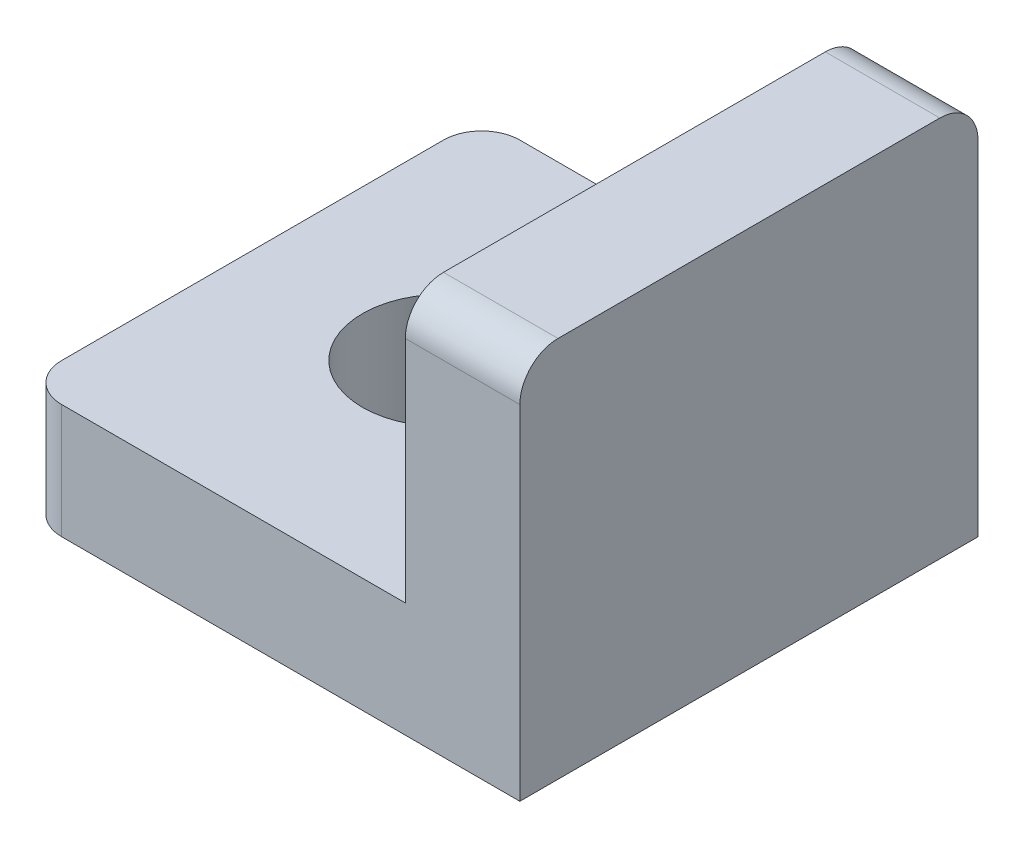
from build123d import *

# Parameters (mm, degrees)
SKETCH_1_W          = 13
SKETCH_1_H          = 12
EXTRUDE_1_DEPTH     = 10
SHELL_1_T           = -3
SKETCH_2_R          = 2.125
CUT_EXTRUDE_1_DEPTH = 13.206555616
SKETCH_3_R          = 2.625
CUT_EXTRUDE_4_DEPTH = 2.5
FILLET_1_R          = 1


with BuildPart() as part:
    # 草圖1 → 填料-伸長1 (new body)
    with BuildSketch(Plane(origin=(0, 0, 0), x_dir=(1, 0, 0), z_dir=(0, 1, 0))):
        with Locations((1.5, 0)):
            Rectangle(SKETCH_1_W, SKETCH_1_H)
    extrude(amount=EXTRUDE_1_DEPTH)

    # 薄殼1
    shell_1_openings = [part.faces().sort_by_distance(p)[0] for p in [
        (1.5, 10, 0),
        (1.5, 5, -6),
        (1.5, 5, 6),
        (-5, 5, 0),
    ]]
    offset(amount=SHELL_1_T, openings=shell_1_openings, kind=Kind.INTERSECTION)

    # 草圖2 → 除料-伸長1 (cut, through all)
    with BuildSketch(Plane(origin=(0, 3, 0), x_dir=(1, 0, 0), z_dir=(0, 1, 0))):
        with Locations(Location((0, 0, 0), (0, 0, 270))):
            Circle(SKETCH_2_R)
    extrude(amount=-CUT_EXTRUDE_1_DEPTH, mode=Mode.SUBTRACT)

    # 草圖3 → 除料-伸長4 (cut)
    with BuildSketch(Plane(origin=(5, 0, 0), x_dir=(0, 0, -1), z_dir=(1, 0, 0))):
        with Locations((0, 6.5)):
            Circle(SKETCH_3_R)
    extrude(amount=CUT_EXTRUDE_4_DEPTH, mode=Mode.SUBTRACT)

    # 圓角1
    fillet_1_edges = [part.edges().sort_by_distance(p)[0] for p in [
        (6.5, 10, -6),
        (-5, 1.5, -6),
        (-5, 1.5, 6),
        (6.5, 10, 6),
    ]]
    fillet(fillet_1_edges, radius=FILLET_1_R)


solid = part.part
